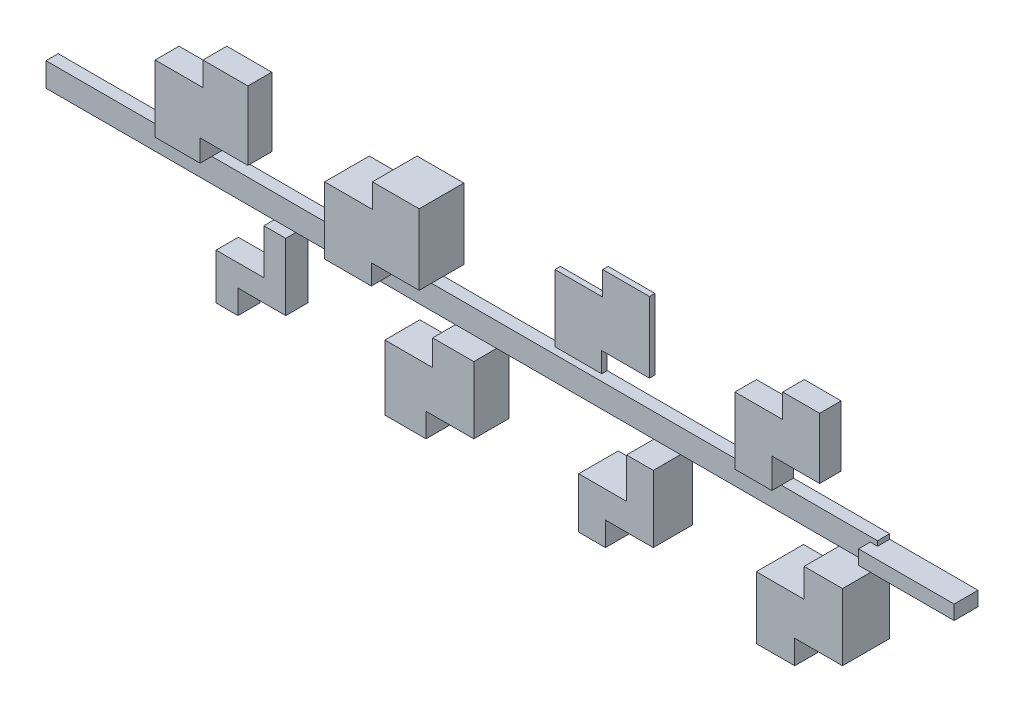
from build123d import *

# Parameters (mm, degrees)
SKETCH_1_W          = 18
SKETCH_1_H          = 0.5
EXTRUDE_1_DEPTH     = 0.25457
EXTRUDE_3_DEPTH     = 0.5
EXTRUDE_4_DEPTH     = 0.93474
EXTRUDE_5_DEPTH     = 0.11451
EXTRUDE_6_DEPTH     = 0.45035
EXTRUDE_7_DEPTH     = 0.46671
EXTRUDE_8_DEPTH     = 0.73227
EXTRUDE_9_DEPTH     = 0.82582
EXTRUDE_10_DEPTH    = 0.98745
SKETCH_14_W         = 0.25457
SKETCH_14_H         = 0.5
CUT_EXTRUDE_1_DEPTH = 0.59794
SKETCH_15_W         = 2
SKETCH_15_H         = 0.3
EXTRUDE_11_DEPTH    = 0.5


with BuildPart() as part:
    # 草图1 → 凸台-拉伸1 (new body)
    with BuildSketch(Plane.XY):
        Rectangle(SKETCH_1_W, SKETCH_1_H)
    extrude(amount=EXTRUDE_1_DEPTH)

    # 草图14 → 切除-拉伸1 (cut)
    with BuildSketch(Plane(origin=(9, 0, 0), x_dir=(0, 0, -1), z_dir=(1, 0, 0))):
        with Locations((-0.127285, 0)):
            Rectangle(SKETCH_14_W, SKETCH_14_H)
    extrude(amount=-CUT_EXTRUDE_1_DEPTH, mode=Mode.SUBTRACT)


with BuildPart() as body_2:
    # 草图5 → 凸台-拉伸3 (new body)
    with BuildSketch(Plane.XY):
        Polygon((-5.470505, 2.15), (-5.470505, 1.65), (-6.470505, 1.65), (-6.470505, 0.25), (-5.529495, 0.25), (-5.529495, 0.70899), (-4.529495, 0.70899), (-4.529495, 2.15), align=None)
    extrude(amount=EXTRUDE_3_DEPTH)


with BuildPart() as body_3:
    # 草图6 → 凸台-拉伸4 (new body)
    with BuildSketch(Plane.XY):
        Polygon((-1, 2.15), (-1.489025, 2.15), (-1.489025, 1.65), (-2.489025, 1.65), (-2.489025, 0.25), (-1.510975, 0.25), (-1.510975, 0.67195), (-0.510975, 0.67195), (-0.510975, 1.302983854), (-0.510975, 2.15), align=None)
    extrude(amount=EXTRUDE_4_DEPTH)


with BuildPart() as body_4:
    # 草图7 → 凸台-拉伸5 (new body)
    with BuildSketch(Plane.XY):
        Polygon((3, 2.15), (2.51029, 2.15), (2.51029, 1.65), (1.51029, 1.65), (1.51029, 0.25), (2.48971, 0.25), (2.48971, 0.67058), (3.48971, 0.67058), (3.48971, 1.301797399), (3.48971, 2.15), align=None)
    extrude(amount=EXTRUDE_5_DEPTH)


with BuildPart() as body_5:
    # 草图8 → 凸台-拉伸6 (new body)
    with BuildSketch(Plane.XY):
        Polygon((7, 2.15), (6.61371, 2.15), (6.61371, 1.65), (5.61371, 1.65), (5.61371, 0.25), (6.38629, 0.25), (6.38629, 0.87742), (7.38629, 0.87742), (7.38629, 1.480926094), (7.38629, 2.15), align=None)
    extrude(amount=EXTRUDE_6_DEPTH)


with BuildPart() as body_6:
    # 草图9 → 凸台-拉伸7 (new body)
    with BuildSketch(Plane.XY):
        Polygon((-5, -2.15), (-4.770925, -2.15), (-4.770925, -1.65), (-3.770925, -1.65), (-3.770925, -0.25), (-4.229075, -0.25), (-4.229075, -1.19185), (-5.229075, -1.19185), (-5.229075, -2.15), align=None)
    extrude(amount=EXTRUDE_7_DEPTH)


with BuildPart() as body_7:
    # 草图11 → 凸台-拉伸8 (new body)
    with BuildSketch(Plane.XY):
        Polygon((-1, -2.15), (-0.56953, -2.15), (-0.56953, -1.65), (0.43047, -1.65), (0.43047, -0.25), (-0.43047, -0.25), (-0.43047, -0.78906), (-1.43047, -0.78906), (-1.43047, -1.404404089), (-1.43047, -2.15), align=None)
    extrude(amount=EXTRUDE_8_DEPTH)


with BuildPart() as body_8:
    # 草图12 → 凸台-拉伸9 (new body)
    with BuildSketch(Plane.XY):
        Polygon((3, -2.15), (3.279625, -2.15), (3.279625, -1.65), (4.279625, -1.65), (4.279625, -0.25), (3.720375, -0.25), (3.720375, -1.09075), (2.720375, -1.09075), (2.720375, -1.665675293), (2.720375, -2.15), align=None)
    extrude(amount=EXTRUDE_9_DEPTH)


with BuildPart() as body_9:
    # 草图13 → 凸台-拉伸10 (new body)
    with BuildSketch(Plane.XY):
        Polygon((7, -2.15), (7.40206, -2.15), (7.40206, -1.65), (8.40206, -1.65), (8.40206, -0.25), (7.59794, -0.25), (7.59794, -0.84588), (6.59794, -0.84588), (6.59794, -1.453611652), (6.59794, -2.15), align=None)
    extrude(amount=EXTRUDE_10_DEPTH)


with BuildPart() as body_10:
    # 草图15 → 凸台-拉伸11 (new body)
    with BuildSketch(Plane.XY):
        with Locations((9.25, 0)):
            Rectangle(SKETCH_15_W, SKETCH_15_H)
    extrude(amount=EXTRUDE_11_DEPTH)


solid = Compound([part.part, body_2.part, body_3.part, body_4.part, body_5.part, body_6.part, body_7.part, body_8.part, body_9.part, body_10.part])
